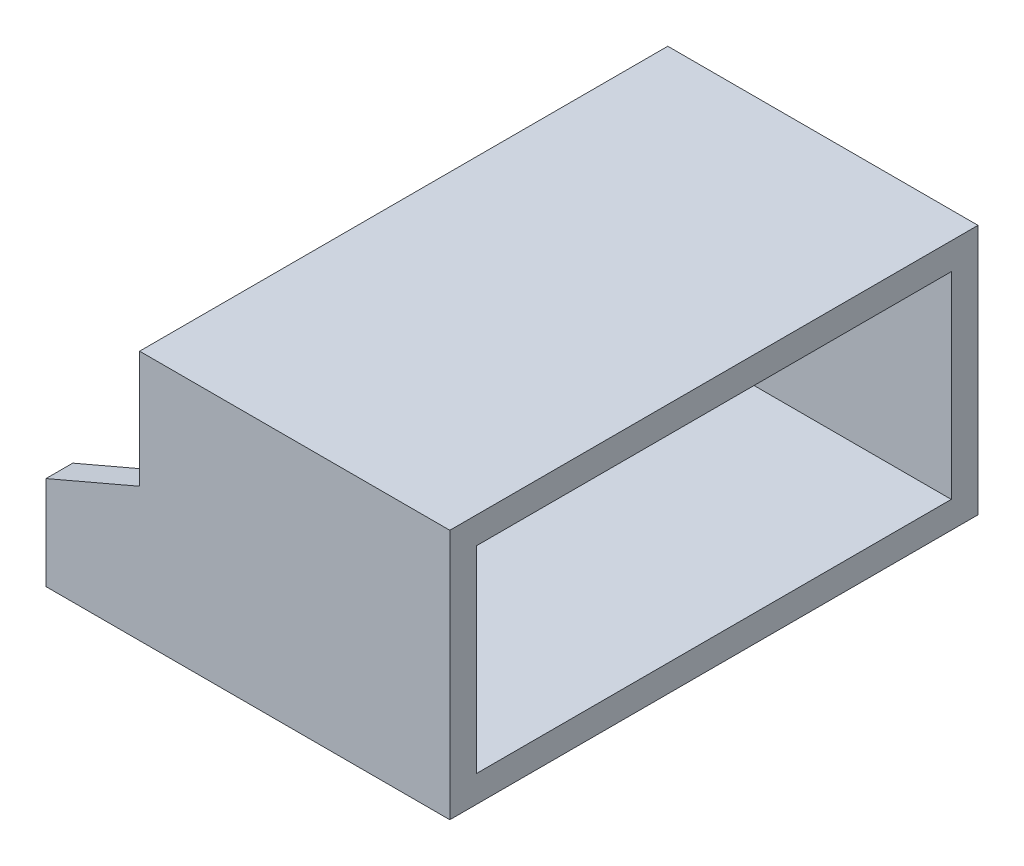
from build123d import *

# Parameters (mm, degrees)
SKETCH1_W           = 5.8928
SKETCH1_H           = 10.033
BOSS_EXTRUDE1_DEPTH = 4.7625
SHELL3_T            = -0.508
BOSS_EXTRUDE2_DEPTH = 0.508
BOSS_EXTRUDE3_DEPTH = 0.508


with BuildPart() as part:
    # Sketch1 → Boss-Extrude1 (new body)
    with BuildSketch(Plane(origin=(0, 0, 0), x_dir=(1, 0, 0), z_dir=(0, 1, 0))):
        with Locations((2.9464, 5.0165)):
            Rectangle(SKETCH1_W, SKETCH1_H)
    extrude(amount=BOSS_EXTRUDE1_DEPTH)

    # Shell3
    shell3_openings = [part.faces().sort_by_distance(p)[0] for p in [
        (5.8928, 2.38125, -5.0165),
    ]]
    offset(amount=SHELL3_T, openings=shell3_openings, kind=Kind.INTERSECTION)

    # Sketch2 → Boss-Extrude2 (add)
    with BuildSketch(Plane.XY):
        Polygon((-1.778, 1.778), (0, 2.54), (0, 0), (-1.778, 0), align=None)
    extrude(amount=-BOSS_EXTRUDE2_DEPTH)

    # Sketch3 → Boss-Extrude3 (add)
    with BuildSketch(Plane(origin=(0, 0, -10.033), x_dir=(-1, 0, 0), z_dir=(0, 0, -1))):
        Polygon((0, 2.54), (1.778, 1.778), (1.778, 0), (0, 0), (0, 1.778), align=None)
    extrude(amount=-BOSS_EXTRUDE3_DEPTH)


solid = part.part
